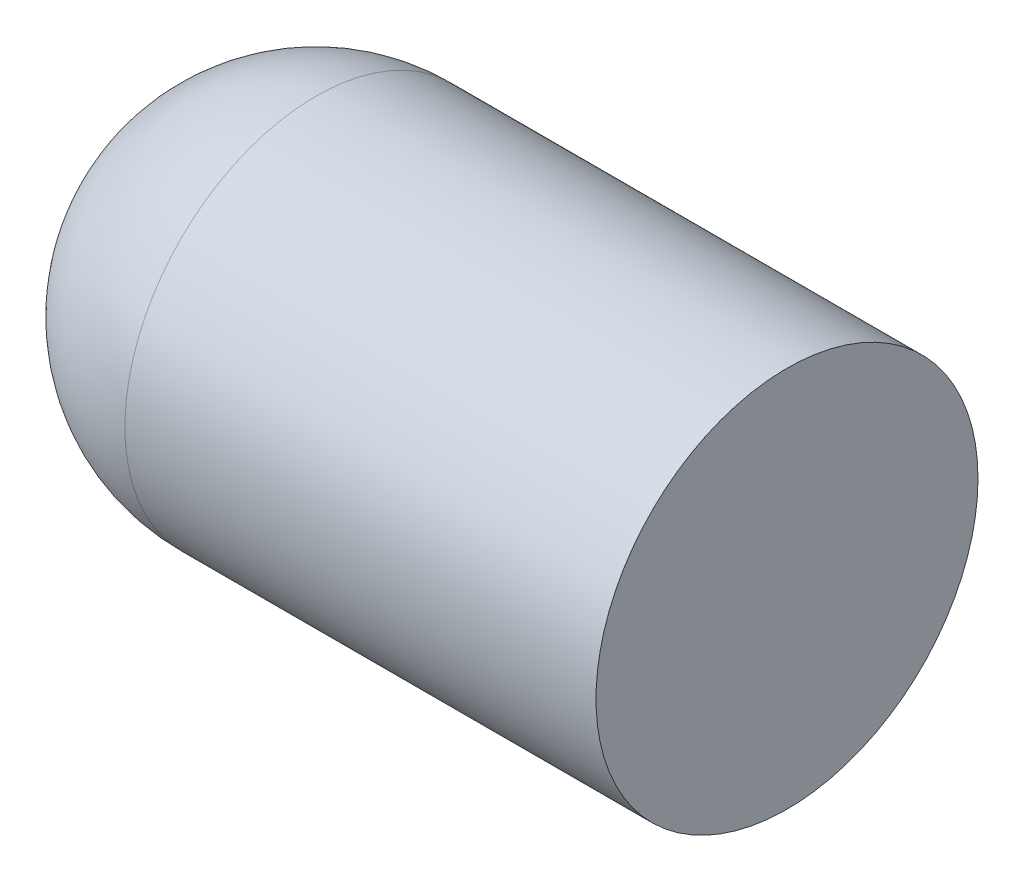
from build123d import *

# Parameters (mm, degrees)
REVOLVE1_ANGLE      = 180
SKETCH2_R           = 1.5
BOSS_EXTRUDE1_DEPTH = 3.7


with BuildPart() as part:
    # Sketch1 → Revolve1 (revolve)
    with BuildSketch(Plane(origin=(0, 0, 0), x_dir=(0, 0, -1), z_dir=(1, 0, 0))):
        with BuildLine():
            Line((0, -1.5), (0, 1.5))
            ThreePointArc((0, 1.5), (1.5, 0), (0, -1.5))
        make_face()
    revolve(axis=Axis((0, -1.5, 0), (0, 1, 0)), revolution_arc=REVOLVE1_ANGLE)

    # Sketch2 → Boss-Extrude1 (add)
    with BuildSketch(Plane(origin=(0, 0, 0), x_dir=(0, 0, -1), z_dir=(1, 0, 0))):
        Circle(SKETCH2_R)
    extrude(amount=BOSS_EXTRUDE1_DEPTH)


solid = part.part
